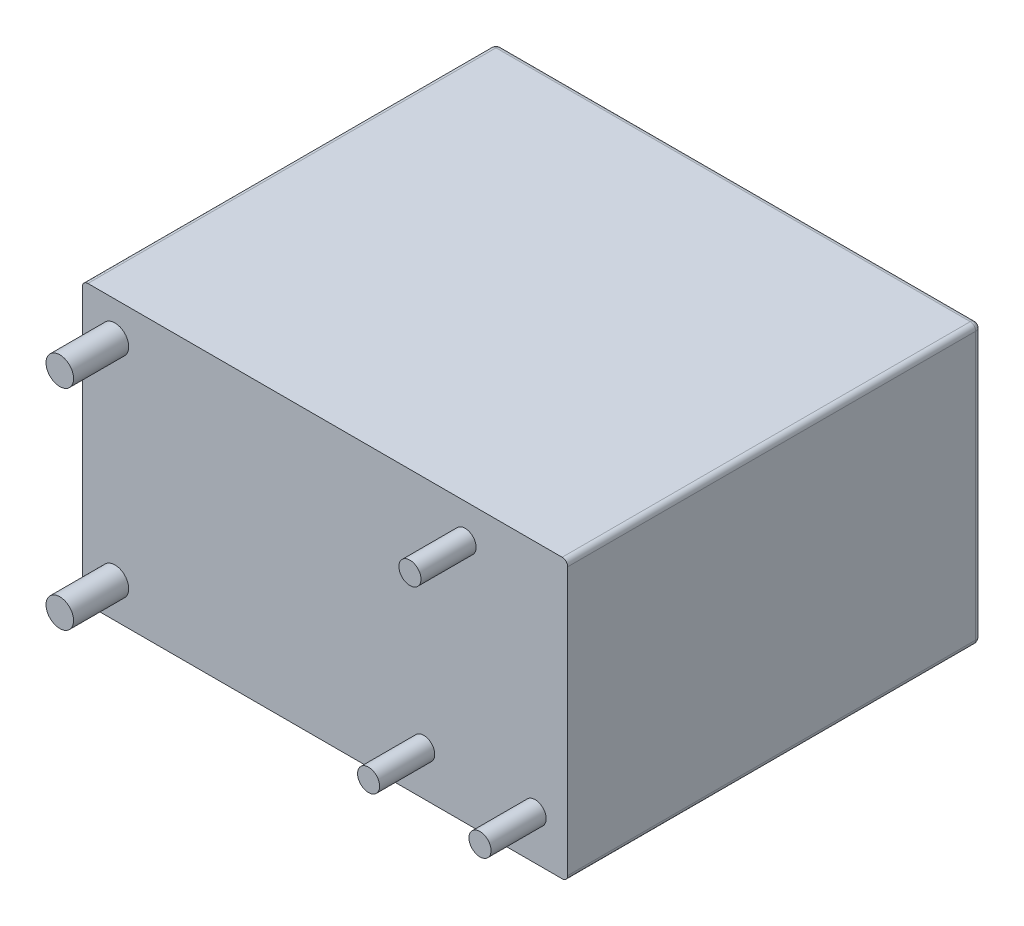
from build123d import *

# Parameters (mm, degrees)
SKETCH_1_W          = 17.6
SKETCH_1_H          = 10.1
EXTRUDE_1_DEPTH     = 15
SKETCH_2_R          = 0.5
SKETCH_2_R_2        = 0.4
EXTRUDE_2_DEPTH     = 2
FILLET_1_R          = 0.2
SKETCH_3_R          = 0.5
CUT_EXTRUDE_1_DEPTH = 0.5


with BuildPart() as part:
    # 草图1 → 凸台-拉伸1 (new body)
    with BuildSketch(Plane.XY):
        with Locations((8.8, 5.05)):
            Rectangle(SKETCH_1_W, SKETCH_1_H)
    extrude(amount=-EXTRUDE_1_DEPTH)

    # 草图2 → 凸台-拉伸2 (add)
    with BuildSketch(Plane.XY):
        with Locations(Location((1.18, 8.85, 0), (0, 0, 180))):
            Circle(SKETCH_2_R)
        with Locations(Location((13.88, 8.85, 0), (0, 0, 180))):
            Circle(SKETCH_2_R_2)
        with Locations(Location((12.38, 1.596982533, 0), (0, 0, 180))):
            Circle(SKETCH_2_R_2)
        with Locations(Location((16.42, 1.596982533, 0), (0, 0, 180))):
            Circle(SKETCH_2_R_2)
        with Locations(Location((1.18, 1.25, 0), (0, 0, 180))):
            Circle(SKETCH_2_R)
    extrude(amount=EXTRUDE_2_DEPTH)

    # 圆角1
    fillet_1_edges = [part.edges().sort_by_distance(p)[0] for p in [
        (17.6, 5.05, -15),
        (8.8, 10.1, -15),
        (0, 5.05, -15),
        (8.8, 0, -15),
        (0, 10.1, -7.5),
        (17.6, 10.1, -7.5),
        (17.6, 0, -7.5),
        (0, 0, -7.5),
    ]]
    fillet(fillet_1_edges, radius=FILLET_1_R)

    # 草图3 → 切除-拉伸1 (cut)
    with BuildSketch(Plane(origin=(0, 0, -15), x_dir=(-1, 0, 0), z_dir=(0, 0, -1))):
        with Locations((-15.4, 8.1)):
            Circle(SKETCH_3_R)
    extrude(amount=-CUT_EXTRUDE_1_DEPTH, mode=Mode.SUBTRACT)


solid = part.part
